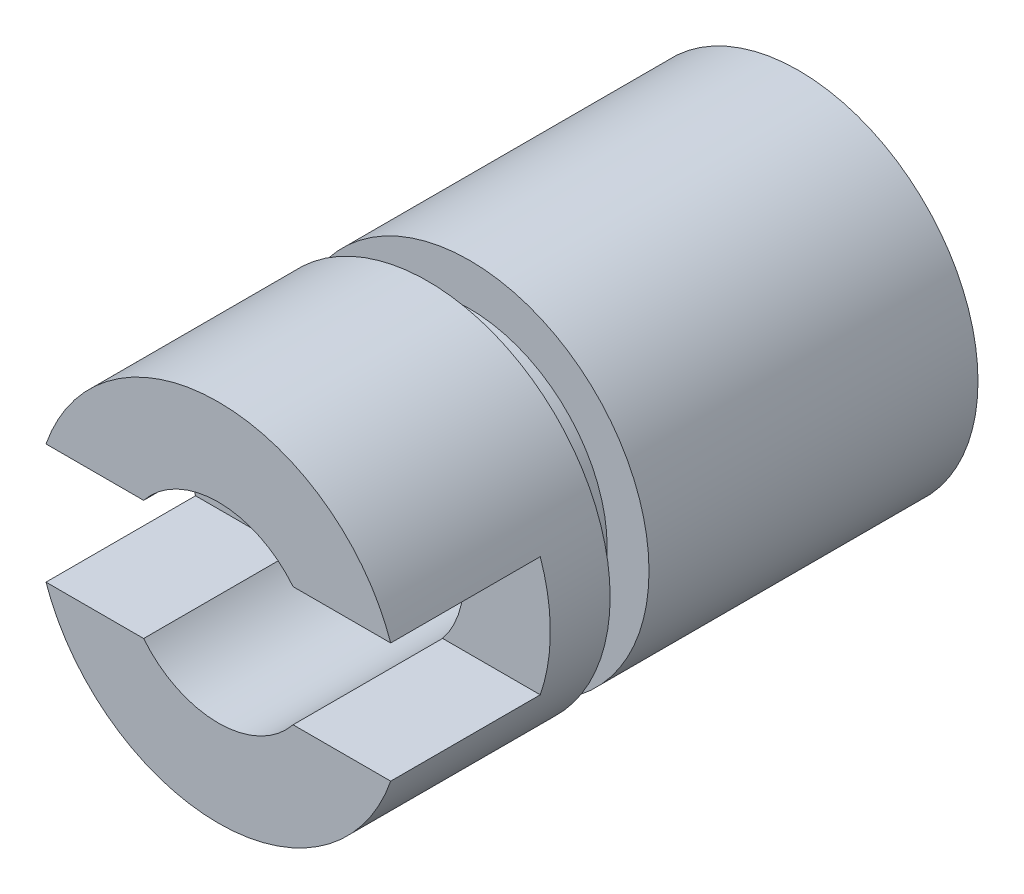
from build123d import *

# Parameters (mm, degrees)
SKETCH1_R           = 3
SKETCH1_R_2         = 1.6
BOSS_EXTRUDE1_DEPTH = 5.5
SKETCH2_R           = 2.3
SKETCH2_R_2         = 1.6
BOSS_EXTRUDE2_DEPTH = 0.7
SKETCH3_R           = 3.05
SKETCH3_R_2         = 2.3
SKETCH3_R_3         = 1.6
BOSS_EXTRUDE3_DEPTH = 3.5
SKETCH4_W           = 6.2
SKETCH4_H           = 2
CUT_EXTRUDE1_DEPTH  = 2.5


with BuildPart() as part:
    # Sketch1 → Boss-Extrude1 (new body)
    with BuildSketch(Plane.XY):
        Circle(SKETCH1_R)
        Circle(SKETCH1_R_2, mode=Mode.SUBTRACT)
    extrude(amount=BOSS_EXTRUDE1_DEPTH)

    # Sketch2 → Boss-Extrude2 (add)
    with BuildSketch(Plane.XY.offset(5.5)):
        Circle(SKETCH2_R)
        Circle(SKETCH2_R_2, mode=Mode.SUBTRACT)
    extrude(amount=BOSS_EXTRUDE2_DEPTH)

    # Sketch3 → Boss-Extrude3 (add)
    # profile 1 of 2: a face of its own
    with BuildSketch(Plane.XY.offset(6.2)):
        Circle(SKETCH3_R)
        Circle(SKETCH3_R_2, mode=Mode.SUBTRACT)
    # profile 2 of 2: a face of its own
    with BuildSketch(Plane.XY.offset(6.2)):
        Circle(SKETCH3_R_2)
        Circle(SKETCH3_R_3, mode=Mode.SUBTRACT)
    extrude(amount=BOSS_EXTRUDE3_DEPTH)

    # Sketch4 → Cut-Extrude1 (cut)
    with BuildSketch(Plane.XY.offset(9.7)):
        Rectangle(SKETCH4_W, SKETCH4_H)
    extrude(amount=-CUT_EXTRUDE1_DEPTH, mode=Mode.SUBTRACT)


solid = part.part
